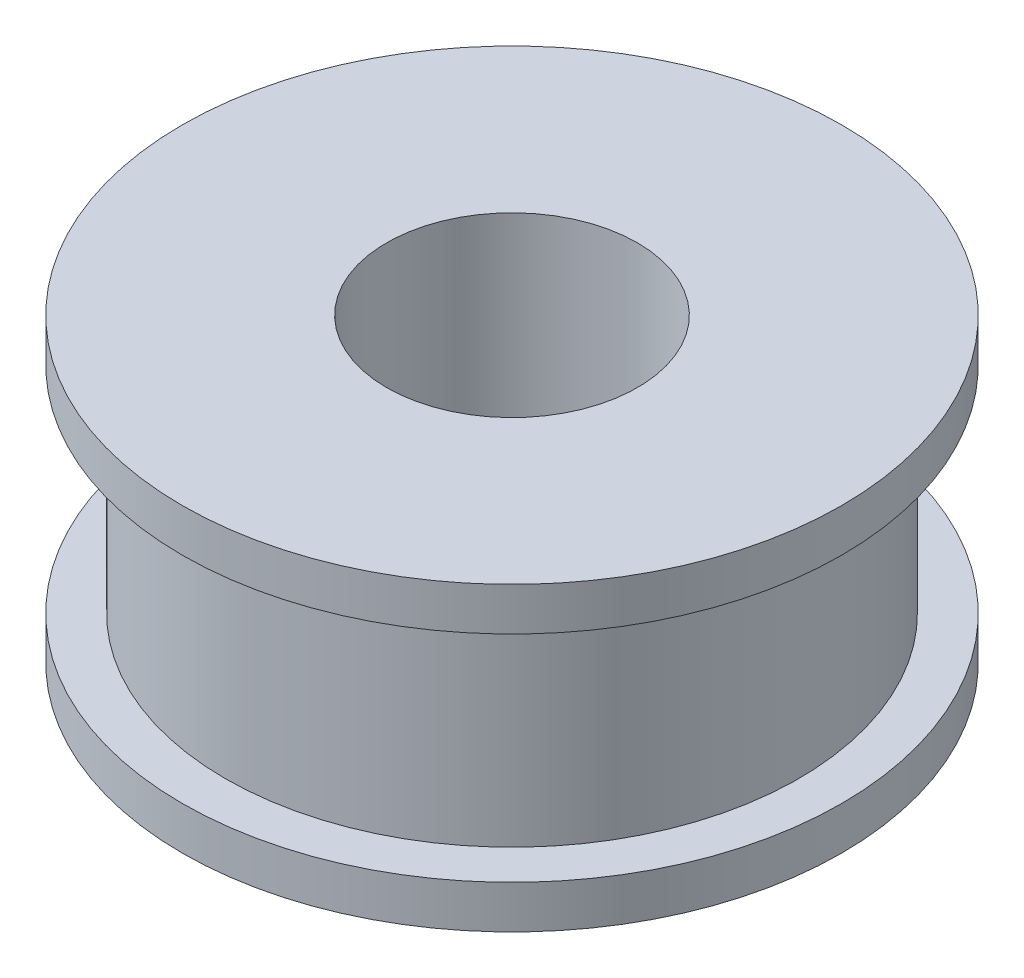
from build123d import *

# Parameters (mm, degrees)
SKETCH_1_R          = 4
EXTRUDE_1_DEPTH     = 3
SKETCH_3_R          = 4.6
EXTRUDE_2_DEPTH     = 0.6
EXTRUDE_START       = 0.6
SKETCH_4_R          = 4.6
EXTRUDE_3_DEPTH     = 0.6
SKETCH_5_R          = 1.75
CUT_EXTRUDE_1_DEPTH = 11


with BuildPart() as part:
    # 草图1 → 凸台-拉伸1 (new body)
    with BuildSketch(Plane(origin=(0, 0, 0), x_dir=(1, 0, 0), z_dir=(0, 1, 0))):
        with Locations(Location((0, 0, 0), (0, 0, 270))):
            Circle(SKETCH_1_R)
    extrude(amount=EXTRUDE_1_DEPTH)

    # 草图3 → 凸台-拉伸2 (add)
    with BuildSketch(Plane(origin=(0, 3, 0), x_dir=(1, 0, 0), z_dir=(0, 1, 0))):
        with Locations(Location((0, 0, 0), (0, 0, 270))):
            Circle(SKETCH_3_R)
    extrude(amount=EXTRUDE_2_DEPTH)

    # 草图4 → 凸台-拉伸3 (add)
    with BuildSketch(Plane.XZ.offset(EXTRUDE_START)):
        with Locations(Location((0, 0, 0), (0, 0, 90))):
            Circle(SKETCH_4_R)
    extrude(amount=-EXTRUDE_3_DEPTH)

    # 草图5 → 切除-拉伸1 (cut)
    with BuildSketch(Plane.XZ.offset(0.6)):
        with Locations(Location((0, 0, 0), (0, 0, 270))):
            Circle(SKETCH_5_R)
    extrude(amount=-CUT_EXTRUDE_1_DEPTH, mode=Mode.SUBTRACT)


solid = part.part
